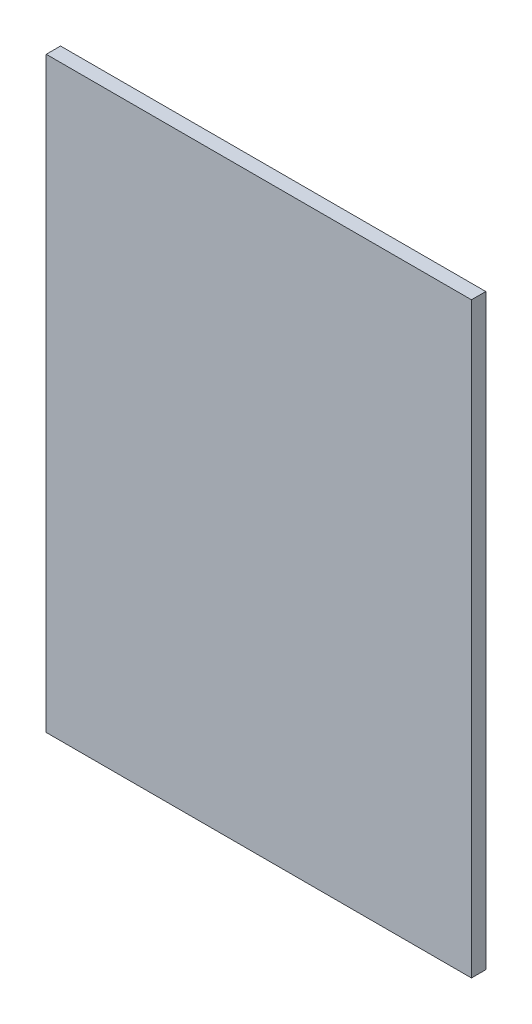
from build123d import *

# Parameters (mm, degrees)
BOSS_EXTRUDE1_DEPTH = 1.6822


with BuildPart() as part:
    # Sketch1 → Boss-Extrude1 (new body)
    with BuildSketch(Plane.XY.offset(-13.060981884)):
        Polygon((15.377687466, -37.908851547), (15.377687466, 28.080348453), (23.454887466, 28.080348453), (23.454887466, 30.188548453), (14.463287466, 30.188548453), (14.463287466, -38.823251547), (64.425087466, -38.823251547), (64.425087466, 30.188548453), (55.204887466, 30.188548453), (55.204887466, 28.080348453), (63.510687466, 28.080348453), (63.510687466, -37.908851547), align=None)
        Polygon((55.204887466, 28.080348453), (55.204887466, 30.188548453), (23.454887466, 30.188548453), (23.454887466, 28.080348453), (15.377687466, 28.080348453), (15.377687466, -37.908851547), (63.510687466, -37.908851547), (63.510687466, 28.080348453), align=None)
    extrude(amount=BOSS_EXTRUDE1_DEPTH)


solid = part.part
